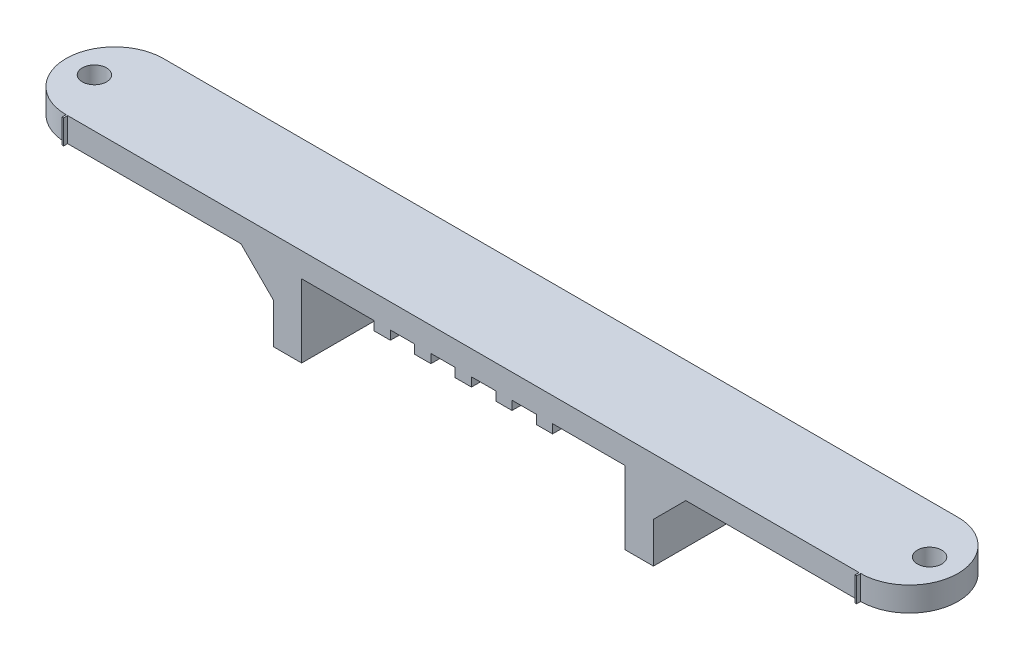
from build123d import *

# Parameters (mm, degrees)
SKETCH1_R           = 1.5
BOSS_EXTRUDE1_DEPTH = 3
SKETCH4_W           = 3.5
SKETCH4_H           = 12
BOSS_EXTRUDE3_DEPTH = 9
SKETCH5_W           = 2
SKETCH5_H           = 12
BOSS_EXTRUDE4_DEPTH = 1.1
SKETCH6_W           = 0.2
SKETCH6_H           = 3
BOSS_EXTRUDE5_DEPTH = 0.5
CHAMFER1_SIZE       = 4


with BuildPart() as part:
    # Sketch1 → Boss-Extrude1 (new body)
    with BuildSketch(Plane(origin=(0, 0, 0), x_dir=(1, 0, 0), z_dir=(0, 1, 0))):
        with BuildLine():
            Line((-49, 6), (49, 6))
            ThreePointArc((49, 6), (55, 0), (49, -6))
            Line((49, -6), (-49, -6))
            ThreePointArc((-49, -6), (-55, 0), (-49, 6))
        make_face()
        with Locations(Location((-51.5, 0, 0), (0, 0, 270))):
            Circle(SKETCH1_R, mode=Mode.SUBTRACT)
        with Locations(Location((51.5, 0, 0), (0, 0, 270))):
            Circle(SKETCH1_R, mode=Mode.SUBTRACT)
    extrude(amount=BOSS_EXTRUDE1_DEPTH)

    # Sketch4 → Boss-Extrude3 (add)
    with BuildSketch(Plane.XZ):
        with Locations((-21.690023983, 0)):
            Rectangle(SKETCH4_W, SKETCH4_H)
        with Locations((21.690023983, 0)):
            Rectangle(SKETCH4_W, SKETCH4_H)
    extrude(amount=BOSS_EXTRUDE3_DEPTH)

    # Sketch5 → Boss-Extrude4 (add)
    with BuildSketch(Plane.XZ):
        with Locations((5, 0)):
            Rectangle(SKETCH5_W, SKETCH5_H)
        Rectangle(SKETCH5_W, SKETCH5_H)
        with Locations((10, 0)):
            Rectangle(SKETCH5_W, SKETCH5_H)
        with Locations((-5, 0)):
            Rectangle(SKETCH5_W, SKETCH5_H)
        with Locations((-10, 0)):
            Rectangle(SKETCH5_W, SKETCH5_H)
    extrude(amount=BOSS_EXTRUDE4_DEPTH)

    # Sketch6 → Boss-Extrude5 (add)
    with BuildSketch(Plane.XY.offset(6)):
        with Locations((48.9, 1.5)):
            Rectangle(SKETCH6_W, SKETCH6_H)
        with Locations((-48.9, 1.5)):
            Rectangle(SKETCH6_W, SKETCH6_H)
    extrude(amount=BOSS_EXTRUDE5_DEPTH)

    # Chamfer1
    chamfer1_edges = [part.edges().sort_by_distance(p)[0] for p in [
        (-23.440023983, 0, 0),
        (23.440023983, 0, 0),
    ]]
    chamfer(chamfer1_edges, length=CHAMFER1_SIZE)


solid = part.part
